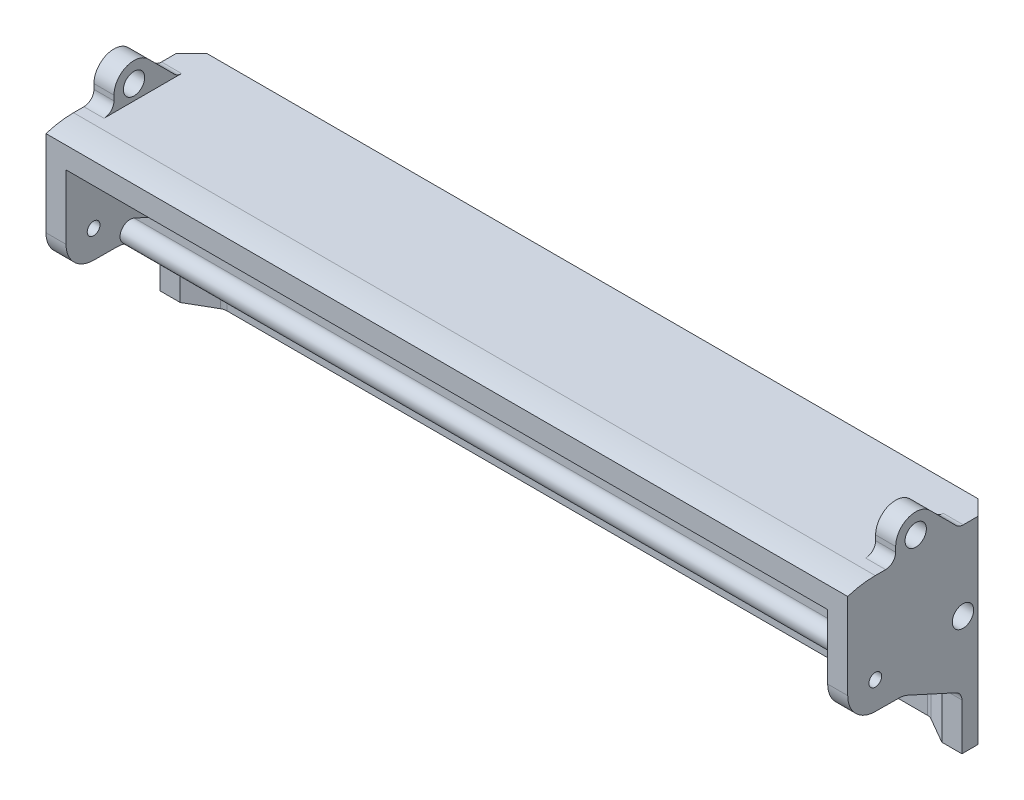
from build123d import *

# Parameters (mm, degrees)
SKETCH1_R           = 2.0193
SKETCH1_R_2         = 3.3782
BOSS_EXTRUDE1_DEPTH = 6.35
BOSS_EXTRUDE2_START = 120.65
BOSS_EXTRUDE2_DEPTH = 120.65
BOSS_EXTRUDE3_REACH = 145.827
SKETCH6_R           = 3.3782
BOSS_EXTRUDE4_DEPTH = 6.35
FILLET2_R           = 3.175
CHAMFER1_SIZE       = 4.826


with BuildPart() as part:
    # Sketch1 → Boss-Extrude1 (new body)
    with BuildSketch(Plane(origin=(0, 0, 0), x_dir=(0, 0, -1), z_dir=(1, 0, 0))):
        with BuildLine():
            Line((19.857637877, 39.149224239), (42.164, 28.956))
            Line((42.164, 28.956), (42.164, 14.4653))
            Line((42.164, 14.4653), (46.99, 14.4653))
            Line((46.99, 14.4653), (46.99, 77.089))
            Line((46.99, 77.089), (9.62025, 77.089))
            ThreePointArc((9.62025, 77.089), (5.201472483, 76.745277517), (0.889, 75.722379195))
            Line((0.889, 75.722379195), (0.889, 48.514))
            ThreePointArc((0.889, 48.514), (3.422551022, 42.363938704), (9.552880645, 39.783009911))
            Line((9.552880645, 39.783009911), (17.267409525, 39.723483692))
            ThreePointArc((17.267409525, 39.723483692), (18.59285001, 39.573142424), (19.857637877, 39.149224239))
        make_face()
        with Locations((9.62025, 48.514)):
            Circle(SKETCH1_R, mode=Mode.SUBTRACT)
        with Locations((37.4015, 52.0954)):
            Circle(SKETCH1_R_2, mode=Mode.SUBTRACT)
    extrude(amount=-BOSS_EXTRUDE1_DEPTH)

    # Sketch2 → Boss-Extrude2 (add)
    with BuildSketch(Plane(origin=(0, 0, 0), x_dir=(0, 0, -1), z_dir=(1, 0, 0)).offset(BOSS_EXTRUDE2_START)):
        with BuildLine():
            Line((42.164, 35.93758433), (22.496862123, 44.924775761))
            ThreePointArc((22.496862123, 44.924775761), (18.289474239, 43.356612123), (19.857637877, 39.149224239))
            Line((19.857637877, 39.149224239), (42.164, 28.956))
            Line((42.164, 28.956), (42.164, 14.4653))
            Line((42.164, 14.4653), (46.99, 14.4653))
            Line((46.99, 14.4653), (46.99, 77.089))
            Line((46.99, 77.089), (9.62025, 77.089))
            ThreePointArc((9.62025, 77.089), (5.201472483, 76.745277517), (0.889, 75.722379195))
            Line((0.889, 75.722379195), (0.889, 68.952099188))
            ThreePointArc((0.889, 68.952099188), (5.164137875, 70.287692607), (9.62025, 70.739))
            Line((9.62025, 70.739), (42.164, 70.739))
            Line((42.164, 70.739), (42.164, 35.93758433))
        make_face()
    extrude(amount=-BOSS_EXTRUDE2_DEPTH)

    # Boss-Extrude3: up to this plane
    boss_extrude3_end = Plane(origin=(-6.35, 39.893111336, -18.2297511), z_dir=(0, -0.909535672675175, 0.41562586557060793))
    # Sketch5 → Boss-Extrude3 (add, up to the surface)
    with BuildSketch(Plane.XZ.offset(-14.4653), mode=Mode.PRIVATE) as boss_extrude3_sk1:
        Polygon((-3.858864353, -42.164), (8.841135647, -42.164), (6.8e-08, -37.059567994), (-6.35, -37.059567994), (-6.35, -40.725742164), align=None)
    boss_extrude3_tool1 = split(extrude(boss_extrude3_sk1.sketch, amount=-BOSS_EXTRUDE3_REACH, mode=Mode.PRIVATE), bisect_by=boss_extrude3_end, keep=Keep.BOTH, mode=Mode.PRIVATE)
    add(boss_extrude3_tool1.solids().sort_by_distance((-0.498721, 14.4653, -39.902897))[0])
    # Sketch5 → Boss-Extrude3 (add, up to the surface)
    with BuildSketch(Plane.XZ.offset(-14.4653), mode=Mode.PRIVATE) as boss_extrude3_sk2:
        Polygon((-6.35, -42.164), (-3.858864353, -42.164), (-6.35, -40.725742164), align=None)
    boss_extrude3_tool2 = split(extrude(boss_extrude3_sk2.sketch, amount=-BOSS_EXTRUDE3_REACH, mode=Mode.PRIVATE), bisect_by=boss_extrude3_end, keep=Keep.BOTH, mode=Mode.PRIVATE)
    add(boss_extrude3_tool2.solids().sort_by_distance((-5.519621, 14.4653, -41.684581))[0])

    # Sketch6 → Boss-Extrude4 (add)
    with BuildSketch(Plane.ZY.offset(6.35)):
        with BuildLine():
            Line((-26.918328061, 86.341628061), (-36.170956121, 77.089))
            Line((-36.170956121, 77.089), (-16.0782, 77.089))
            Line((-16.0782, 77.089), (-16.0782, 81.8515))
            ThreePointArc((-16.0782, 81.8515), (-19.998160204, 87.718135031), (-26.918328061, 86.341628061))
        make_face()
        with Locations((-22.4282, 81.8515)):
            Circle(SKETCH6_R, mode=Mode.SUBTRACT)
    extrude(amount=-BOSS_EXTRUDE4_DEPTH)

    # Fillet2
    fillet2_edges = [part.edges().sort_by_distance(p)[0] for p in [
        (60.325, 35.93758433, -42.164),
        (60.325, 70.739, -42.164),
        (64.745567823, 28.956, -42.164),
        (-3.174999966, 31.288546193, -37.059567994),
        (8.841135647, 21.71065, -42.164),
        (4.420567858, 30.122273097, -39.611783997),
        (-3.175, 77.089, -16.0782),
        (-3.175, 77.089, -36.170956121),
    ]]
    fillet(fillet2_edges, radius=FILLET2_R)

    # Mirror1: part across plane


with BuildPart() as part_1:
    add(part.part)
    add(part.part.mirror(Plane(origin=(120.65, 0, 0), x_dir=(0, 0, 1), z_dir=(1, 0, 0))))

    # Chamfer1
    chamfer1_edges = [part_1.edges().sort_by_distance(p)[0] for p in [
        (247.65, 45.77715, -46.99),
        (-6.35, 45.77715, -46.99),
    ]]
    chamfer(chamfer1_edges, length=CHAMFER1_SIZE)


solid = part_1.part
